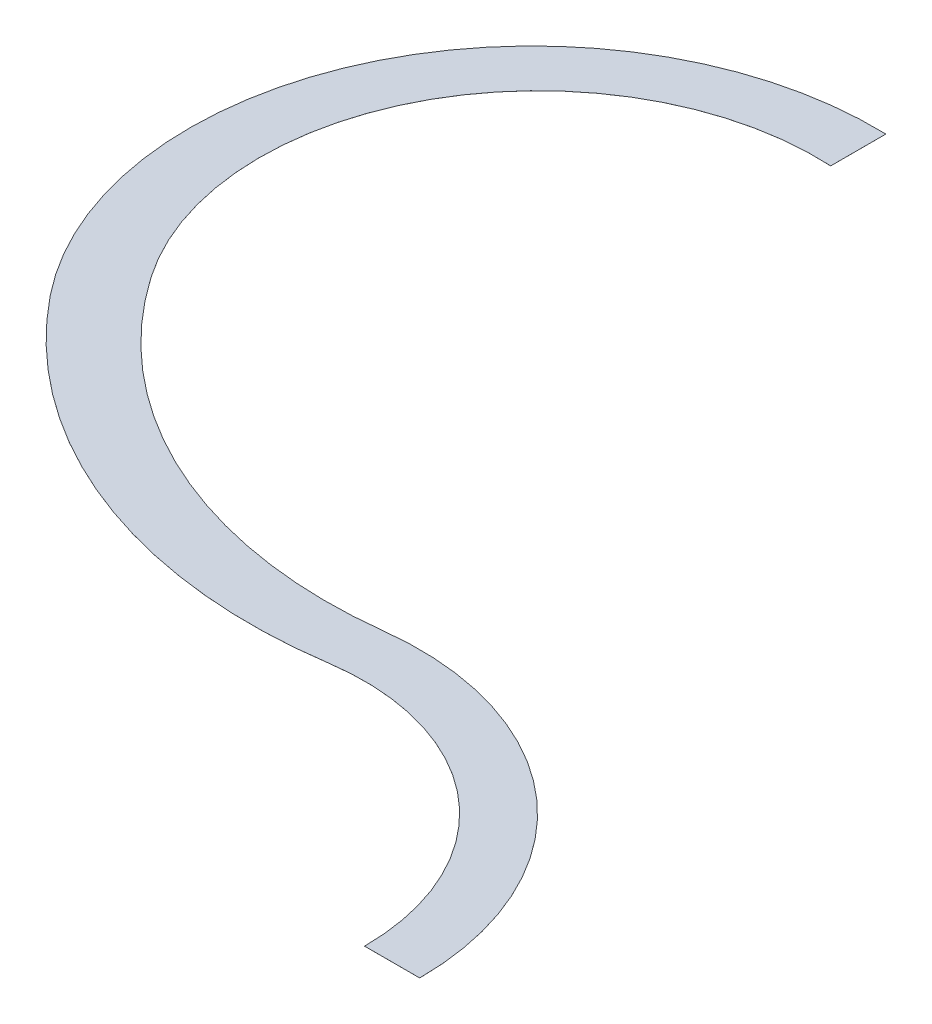
from build123d import *

# Parameters (mm, degrees)
RESSALTO_EXTRUS_O12_DEPTH = 0.01


with BuildPart() as part:
    # Esboço1 → Ressalto-extrusão12 (new body)
    with BuildSketch(Plane(origin=(0, 0, 0), x_dir=(1, 0, 0), z_dir=(0, 1, 0))):
        with BuildLine():
            Line((471.066955747, 763.032639239), (491.066955747, 763.032639239))
            ThreePointArc((491.066955747, 763.032639239), (456.340288786, 840.246051921), (375.530369994, 865.49698301))
            ThreePointArc((375.530369994, 865.49698301), (289.321012385, 878.634763646), (222.246119015, 934.362793386))
            ThreePointArc((222.246119015, 934.362793386), (217.005639738, 1041.042505928), (310.481176611, 1092.717913013))
            Line((310.481176611, 1092.717913013), (310.481176611, 1112.717913013))
            ThreePointArc((310.481176611, 1112.717913013), (195.309478466, 1043.770968842), (209.725811714, 910.315468769))
            ThreePointArc((209.725811714, 910.315468769), (283.985275681, 855.785617748), (375.530369994, 845.418923568))
            ThreePointArc((375.530369994, 845.418923568), (442.170120256, 826.109455627), (471.066955747, 763.032639239))
        make_face()
    extrude(amount=RESSALTO_EXTRUS_O12_DEPTH)


solid = part.part
